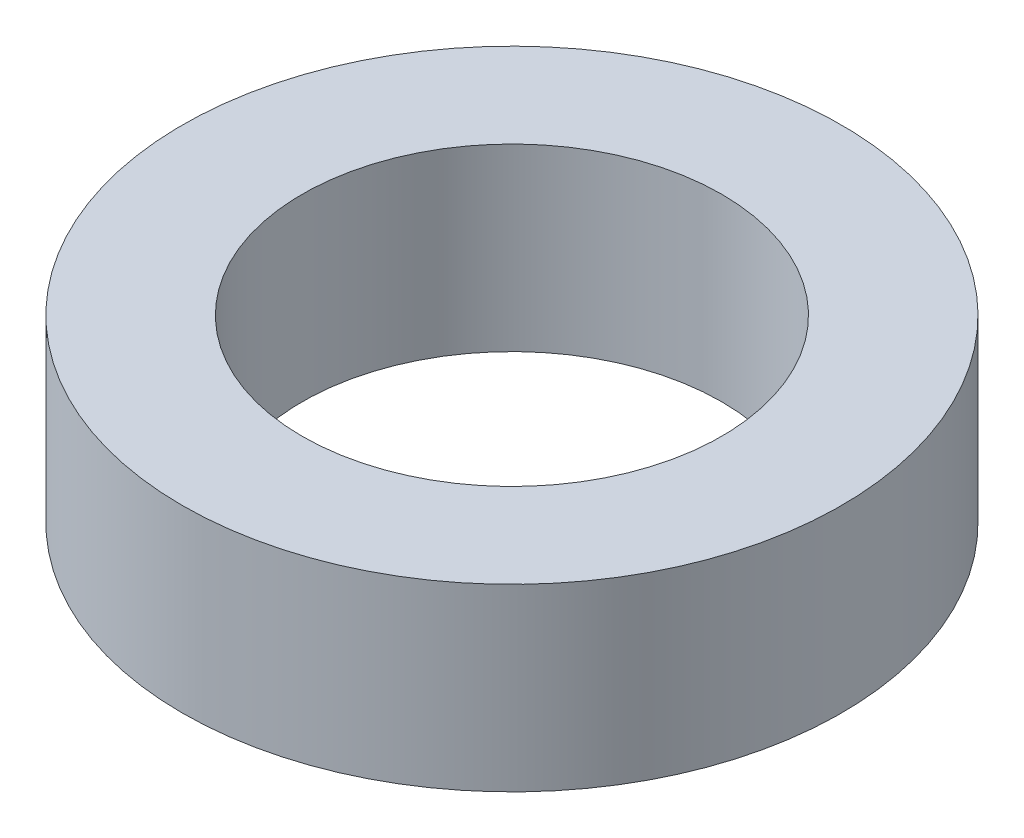
from build123d import *

# Parameters (mm, degrees)
SKETCH1_R           = 5.5
SKETCH1_R_2         = 3.5
BOSS_EXTRUDE1_DEPTH = 3


with BuildPart() as part:
    # Sketch1 → Boss-Extrude1 (new body)
    with BuildSketch(Plane(origin=(0, 0, 0), x_dir=(1, 0, 0), z_dir=(0, 1, 0))):
        with Locations(Location((0, 0, 0), (0, 0, 270))):
            Circle(SKETCH1_R)
        with Locations(Location((0, 0, 0), (0, 0, 270))):
            Circle(SKETCH1_R_2, mode=Mode.SUBTRACT)
    extrude(amount=BOSS_EXTRUDE1_DEPTH)


solid = part.part
